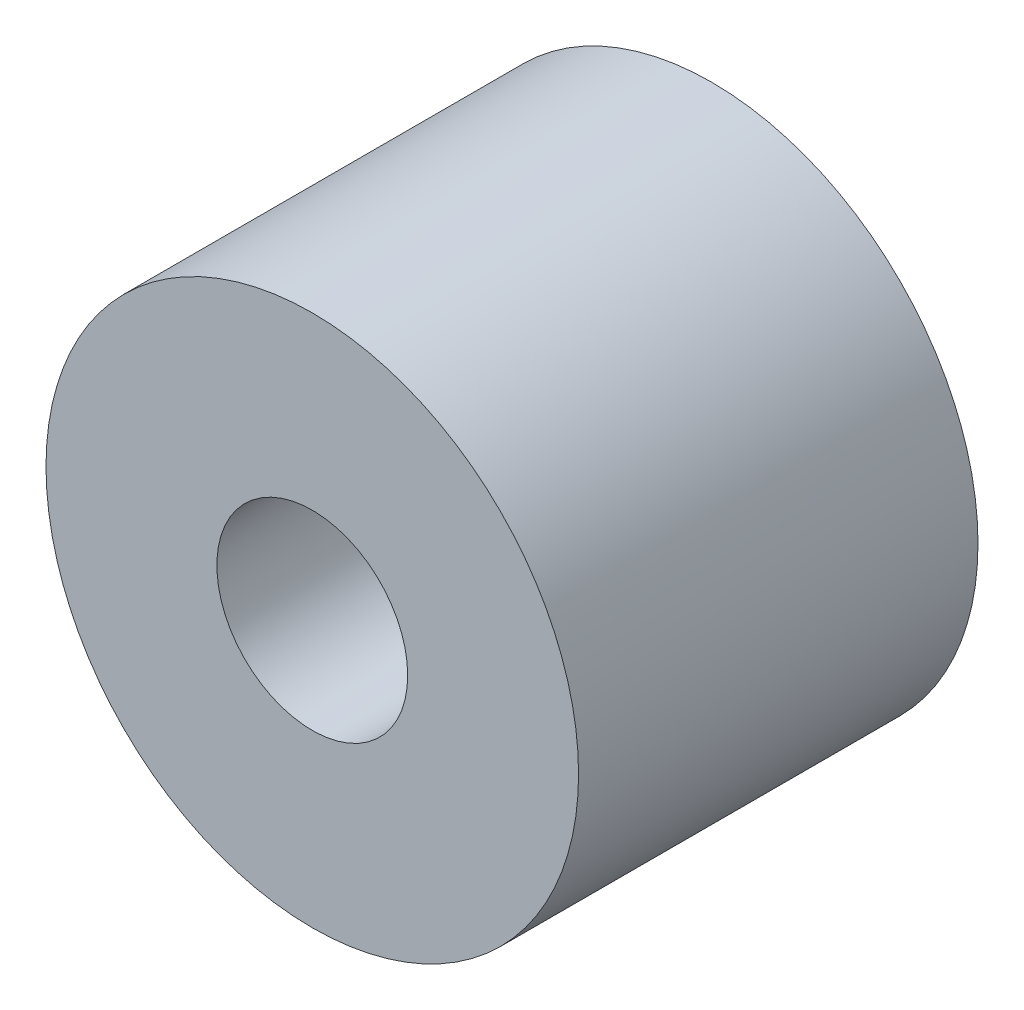
from build123d import *

# Parameters (mm, degrees)
SKETCH_1_R      = 6
SKETCH_1_R_2    = 2.15
EXTRUDE_1_DEPTH = 9


with BuildPart() as part:
    # 草图1 → 凸台-拉伸1 (new body)
    with BuildSketch(Plane.XY):
        Circle(SKETCH_1_R)
        Circle(SKETCH_1_R_2, mode=Mode.SUBTRACT)
    extrude(amount=EXTRUDE_1_DEPTH)


solid = part.part
